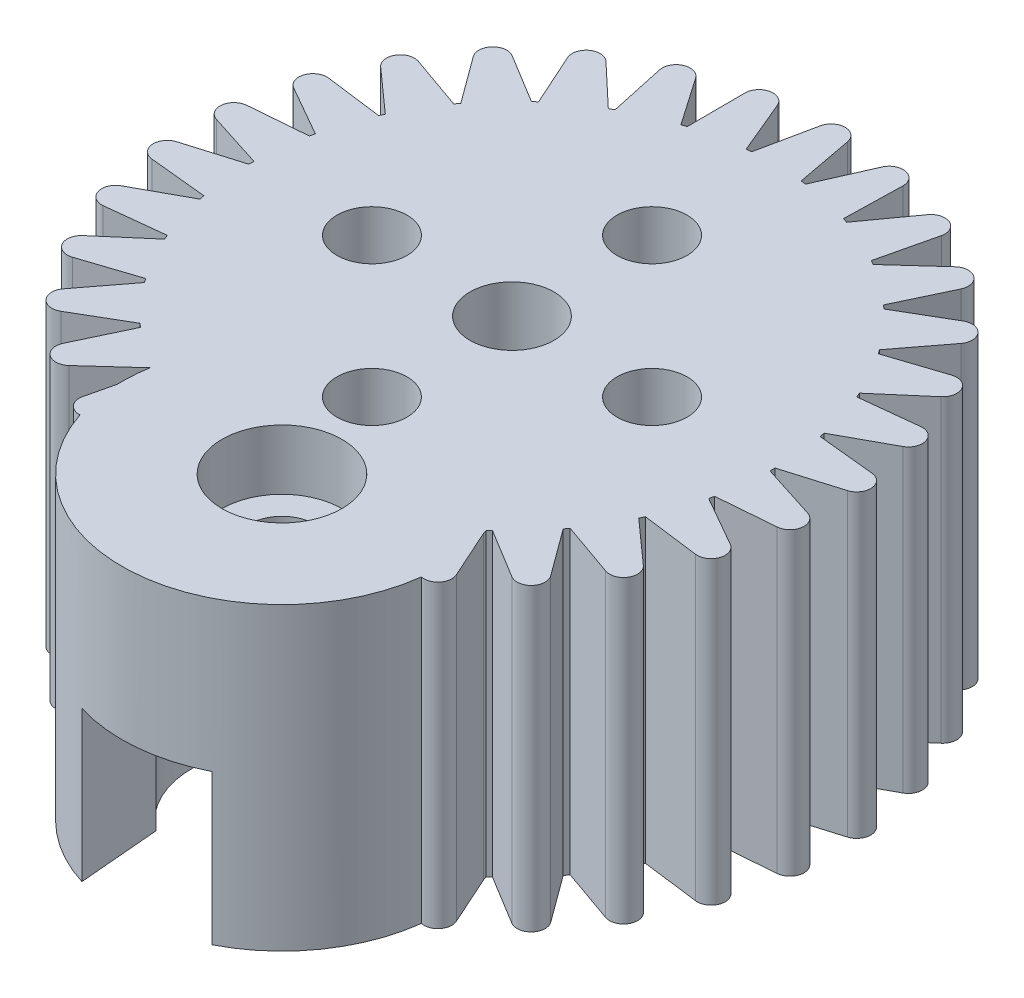
from build123d import *

# Parameters (mm, degrees)
SKETCH_1_R          = 2.1
SKETCH_1_R_2        = 1.75
EXTRUDE_1_DEPTH     = 15
EXTRUDE_4_DEPTH     = 15
CUT_EXTRUDE_2_DEPTH = 7.5
SKETCH_6_R          = 3
CUT_EXTRUDE_3_DEPTH = 3
SKETCH_7_R          = 1.65
CUT_EXTRUDE_4_DEPTH = 7.5


with BuildPart() as part:
    # 草图1 → 凸台-拉伸1 (new body)
    with BuildSketch(Plane(origin=(0, 0, 0), x_dir=(1, 0, 0), z_dir=(0, 1, 0))):
        with BuildLine():
            Line((13.15, 0), (15.928328767, 0.831197488))
            ThreePointArc((15.928328767, 0.831197488), (16.42452517, 1.568368494), (15.797783898, 2.198310824))
            Line((15.797783898, 2.198310824), (12.912357414, 2.48867957))
            ThreePointArc((12.912357414, 2.48867957), (12.888083079, 2.611477465), (12.86264095, 2.734038734))
            Line((12.86264095, 2.734038734), (15.407440892, 4.124719594))
            ThreePointArc((15.407440892, 4.124719594), (15.739527743, 4.948946678), (14.995509896, 5.43481642))
            Line((14.995509896, 5.43481642), (12.112765847, 5.118926013))
            ThreePointArc((12.112765847, 5.118926013), (12.063490846, 5.233993562), (12.013122768, 5.348586856))
            Line((12.013122768, 5.348586856), (14.213173917, 7.237971662))
            ThreePointArc((14.213173917, 7.237971662), (14.366637427, 8.113232145), (13.537860156, 8.433794459))
            Line((13.537860156, 8.433794459), (10.783788289, 7.525450826))
            ThreePointArc((10.783788289, 7.525450826), (10.711666177, 7.627759024), (10.638573476, 7.729376068))
            Line((10.638573476, 7.729376068), (12.397723039, 10.034889636))
            ThreePointArc((12.397723039, 10.034889636), (12.365856116, 10.922930435), (11.488540964, 11.06417521))
            Line((11.488540964, 11.06417521), (8.983507437, 9.603077326))
            ThreePointArc((8.983507437, 9.603077326), (8.891690295, 9.688154814), (8.799067474, 9.772354455))
            Line((8.799067474, 9.772354455), (10.040432174, 12.393234781))
            ThreePointArc((10.040432174, 12.393234781), (9.824627556, 13.255244252), (8.937117405, 13.210998413))
            Line((8.937117405, 13.210998413), (6.790604202, 11.261003267))
            ThreePointArc((6.790604202, 11.261003267), (6.68310488, 11.32513175), (6.575, 11.38823406))
            Line((6.575, 11.38823406), (7.244326243, 14.209936096))
            ThreePointArc((7.244326243, 14.209936096), (6.854015627, 15.008240289), (5.99509893, 14.780437591))
            Line((5.99509893, 14.780437591), (4.300918978, 12.426769329))
            ThreePointArc((4.300918978, 12.426769329), (4.182435713, 12.467146085), (4.063573476, 12.506393189))
            Line((4.063573476, 12.506393189), (4.131608494, 15.405595017))
            ThreePointArc((4.131608494, 15.405595017), (3.583850326, 16.105304208), (2.791065864, 15.703900723))
            Line((2.791065864, 15.703900723), (1.623262957, 13.04942594))
            ThreePointArc((1.623262957, 13.04942594), (1.498974036, 13.064286312), (1.374549292, 13.077962924))
            Line((1.374549292, 13.077962924), (0.838319627, 15.927955511))
            ThreePointArc((0.838319627, 15.927955511), (0.157053569, 16.498489051), (-0.534950174, 15.941028037))
            Line((-0.534950174, 15.941028037), (-1.125337445, 13.10176002))
            ThreePointArc((-1.125337445, 13.10176002), (-1.25, 13.090454538), (-1.374549292, 13.077962924))
            Line((-1.374549292, 13.077962924), (-2.49160783, 15.754187919))
            ThreePointArc((-2.49160783, 15.754187919), (-3.276607183, 16.170610754), (-3.837586321, 15.481455933))
            Line((-3.837586321, 15.481455933), (-3.8247552, 12.581484318))
            ThreePointArc((-3.8247552, 12.581484318), (-3.944343037, 12.544507085), (-4.063573476, 12.506393189))
            Line((-4.063573476, 12.506393189), (-5.712640068, 14.891886718))
            ThreePointArc((-5.712640068, 14.891886718), (-6.567064478, 15.135999172), (-6.972501532, 14.345269916))
            Line((-6.972501532, 14.345269916), (-6.3570128, 11.511337379))
            ThreePointArc((-6.3570128, 11.511337379), (-6.466299357, 11.450304477), (-6.575, 11.38823406))
            Line((-6.575, 11.38823406), (-8.684002523, 13.378738608))
            ThreePointArc((-8.684002523, 13.378738608), (-9.570509543, 13.439871795), (-9.802684968, 12.582126767))
            Line((-9.802684968, 12.582126767), (-8.611438437, 9.938089759))
            ThreePointArc((-8.611438437, 9.938089759), (-8.705647366, 9.85566862), (-8.799067474, 9.772354455))
            Line((-8.799067474, 9.772354455), (-11.275832398, 11.280875422))
            ThreePointArc((-11.275832398, 11.280875422), (-12.155677416, 11.15635753), (-12.204444033, 10.269084303))
            Line((-12.204444033, 10.269084303), (-10.489502891, 7.930499928))
            ThreePointArc((-10.489502891, 7.930499928), (-10.564516811, 7.83029275), (-10.638573476, 7.729376068))
            Line((-10.638573476, 7.729376068), (-13.374854289, 8.689983849))
            ThreePointArc((-13.374854289, 8.689983849), (-14.209583858, 8.385256906), (-14.072810329, 7.507233578))
            Line((-14.072810329, 7.507233578), (-11.909125735, 5.576309195))
            ThreePointArc((-11.909125735, 5.576309195), (-11.961666177, 5.462695514), (-12.013122768, 5.348586856))
            Line((-12.013122768, 5.348586856), (-14.889330869, 5.719298283))
            ThreePointArc((-14.889330869, 5.719298283), (-15.642463299, 5.247680319), (-15.326127286, 4.417280723))
            Line((-15.326127286, 4.417280723), (-12.808262637, 2.978406992))
            ThreePointArc((-12.808262637, 2.978406992), (-12.836033332, 2.856352271), (-12.86264095, 2.734038734))
            Line((-12.86264095, 2.734038734), (-15.753072242, 2.498651937))
            ThreePointArc((-15.753072242, 2.498651937), (-16.391692033, 1.88075492), (-15.909618937, 1.134271503))
            Line((-15.909618937, 1.134271503), (-13.147617002, 0.250334112))
            ThreePointArc((-13.147617002, 0.250334112), (-13.149404237, 0.125172727), (-13.15, 0))
            Line((-13.15, 0), (-15.928328767, -0.831197488))
            ThreePointArc((-15.928328767, -0.831197488), (-16.42452517, -1.568368494), (-15.797783898, -2.198310824))
            Line((-15.797783898, -2.198310824), (-12.912357414, -2.48867957))
            ThreePointArc((-12.912357414, -2.48867957), (-12.888083079, -2.611477465), (-12.86264095, -2.734038734))
            Line((-12.86264095, -2.734038734), (-15.407440892, -4.124719594))
            ThreePointArc((-15.407440892, -4.124719594), (-15.739527743, -4.948946678), (-14.995509896, -5.43481642))
            Line((-14.995509896, -5.43481642), (-12.112765847, -5.118926013))
            ThreePointArc((-12.112765847, -5.118926013), (-12.063490846, -5.233993562), (-12.013122768, -5.348586856))
            Line((-12.013122768, -5.348586856), (-14.213173917, -7.237971662))
            ThreePointArc((-14.213173917, -7.237971662), (-14.366637427, -8.113232145), (-13.537860156, -8.433794459))
            Line((-13.537860156, -8.433794459), (-10.783788289, -7.525450826))
            ThreePointArc((-10.783788289, -7.525450826), (-10.711666177, -7.627759024), (-10.638573476, -7.729376068))
            Line((-10.638573476, -7.729376068), (-12.397723039, -10.034889636))
            ThreePointArc((-12.397723039, -10.034889636), (-12.365856116, -10.922930435), (-11.488540964, -11.06417521))
            Line((-11.488540964, -11.06417521), (-8.983507437, -9.603077326))
            ThreePointArc((-8.983507437, -9.603077326), (-8.891690295, -9.688154814), (-8.799067474, -9.772354455))
            Line((-8.799067474, -9.772354455), (-10.040432174, -12.393234781))
            ThreePointArc((-10.040432174, -12.393234781), (-9.824627556, -13.255244252), (-8.937117405, -13.210998413))
            Line((-8.937117405, -13.210998413), (-6.790604202, -11.261003267))
            ThreePointArc((-6.790604202, -11.261003267), (-6.68310488, -11.32513175), (-6.575, -11.38823406))
            Line((-6.575, -11.38823406), (-7.244326243, -14.209936096))
            ThreePointArc((-7.244326243, -14.209936096), (-6.854015627, -15.008240289), (-5.99509893, -14.780437591))
            Line((-5.99509893, -14.780437591), (-4.300918978, -12.426769329))
            ThreePointArc((-4.300918978, -12.426769329), (-4.182435713, -12.467146085), (-4.063573476, -12.506393189))
            Line((-4.063573476, -12.506393189), (-4.131608494, -15.405595017))
            ThreePointArc((-4.131608494, -15.405595017), (-3.583850326, -16.105304208), (-2.791065864, -15.703900723))
            Line((-2.791065864, -15.703900723), (-1.623262957, -13.04942594))
            ThreePointArc((-1.623262957, -13.04942594), (-1.498974036, -13.064286312), (-1.374549292, -13.077962924))
            Line((-1.374549292, -13.077962924), (-0.838319627, -15.927955511))
            ThreePointArc((-0.838319627, -15.927955511), (-0.157053569, -16.498489051), (0.534950174, -15.941028037))
            Line((0.534950174, -15.941028037), (1.125337445, -13.10176002))
            ThreePointArc((1.125337445, -13.10176002), (1.25, -13.090454538), (1.374549292, -13.077962924))
            Line((1.374549292, -13.077962924), (2.49160783, -15.754187919))
            ThreePointArc((2.49160783, -15.754187919), (3.276607183, -16.170610754), (3.837586321, -15.481455933))
            Line((3.837586321, -15.481455933), (3.8247552, -12.581484318))
            ThreePointArc((3.8247552, -12.581484318), (3.944343037, -12.544507085), (4.063573476, -12.506393189))
            Line((4.063573476, -12.506393189), (5.712640068, -14.891886718))
            ThreePointArc((5.712640068, -14.891886718), (6.567064478, -15.135999172), (6.972501532, -14.345269916))
            Line((6.972501532, -14.345269916), (6.3570128, -11.511337379))
            ThreePointArc((6.3570128, -11.511337379), (6.466299357, -11.450304477), (6.575, -11.38823406))
            Line((6.575, -11.38823406), (8.684002523, -13.378738608))
            ThreePointArc((8.684002523, -13.378738608), (9.570509543, -13.439871795), (9.802684968, -12.582126767))
            Line((9.802684968, -12.582126767), (8.611438437, -9.938089759))
            ThreePointArc((8.611438437, -9.938089759), (8.705647366, -9.85566862), (8.799067474, -9.772354455))
            Line((8.799067474, -9.772354455), (11.275832398, -11.280875422))
            ThreePointArc((11.275832398, -11.280875422), (12.155677416, -11.15635753), (12.204444033, -10.269084303))
            Line((12.204444033, -10.269084303), (10.489502891, -7.930499928))
            ThreePointArc((10.489502891, -7.930499928), (10.564516811, -7.83029275), (10.638573476, -7.729376068))
            Line((10.638573476, -7.729376068), (13.374854289, -8.689983849))
            ThreePointArc((13.374854289, -8.689983849), (14.209583858, -8.385256906), (14.072810329, -7.507233578))
            Line((14.072810329, -7.507233578), (11.909125735, -5.576309195))
            ThreePointArc((11.909125735, -5.576309195), (11.961666177, -5.462695514), (12.013122768, -5.348586856))
            Line((12.013122768, -5.348586856), (14.889330869, -5.719298283))
            ThreePointArc((14.889330869, -5.719298283), (15.642463299, -5.247680319), (15.326127286, -4.417280723))
            Line((15.326127286, -4.417280723), (12.808262637, -2.978406992))
            ThreePointArc((12.808262637, -2.978406992), (12.836033332, -2.856352271), (12.86264095, -2.734038734))
            Line((12.86264095, -2.734038734), (15.753072242, -2.498651937))
            ThreePointArc((15.753072242, -2.498651937), (16.391692033, -1.88075492), (15.909618937, -1.134271503))
            Line((15.909618937, -1.134271503), (13.147617002, -0.250334112))
            ThreePointArc((13.147617002, -0.250334112), (13.149404237, -0.125172727), (13.15, 0))
        make_face()
        with Locations(Location((0, 0, 0), (0, 0, 270))):
            Circle(SKETCH_1_R, mode=Mode.SUBTRACT)
        with Locations(Location((0, 7, 0), (0, 0, 270))):
            Circle(SKETCH_1_R_2, mode=Mode.SUBTRACT)
        with Locations(Location((7, 0, 0), (0, 0, 270))):
            Circle(SKETCH_1_R_2, mode=Mode.SUBTRACT)
        with Locations(Location((0, -7, 0), (0, 0, 270))):
            Circle(SKETCH_1_R_2, mode=Mode.SUBTRACT)
        with Locations(Location((-7, 0, 0), (0, 0, 270))):
            Circle(SKETCH_1_R_2, mode=Mode.SUBTRACT)
    extrude(amount=EXTRUDE_1_DEPTH)

    # 草图2 → 凸台-拉伸4 (add)
    with BuildSketch(Plane.XZ):
        with BuildLine():
            ThreePointArc((8.628301334, 9.923452831), (1.127142857, 13.101604825), (-6.80661548, 11.251332619))
            ThreePointArc((-6.80661548, 11.251332619), (1.767985784, 20.55059031), (8.628301334, 9.923452831))
        make_face()
    extrude(amount=-EXTRUDE_4_DEPTH)

    # 草图5 → 切除-拉伸2 (cut)
    with BuildSketch(Plane.XZ):
        with BuildLine():
            Line((-1.619193239, 16.178934134), (-1.271013628, 20.226080108))
            ThreePointArc((-1.271013628, 20.226080108), (1.767985784, 20.55059031), (4.706904923, 19.711794394))
            Line((4.706904923, 19.711794394), (4.358725312, 15.66464842))
            ThreePointArc((4.358725312, 15.66464842), (5.268553565, 10.929262742), (1.371565714, 8.089341854))
            ThreePointArc((1.371565714, 8.089341854), (0.333501893, 8.719486746), (-0.864869727, 8.523108183))
            ThreePointArc((-0.864869727, 8.523108183), (-3.396043111, 12.138787805), (-1.619193239, 16.178934134))
        make_face()
    extrude(amount=-CUT_EXTRUDE_2_DEPTH, mode=Mode.SUBTRACT)

    # 草图6 → 切除-拉伸3 (cut)
    with BuildSketch(Plane(origin=(0, 15, 0), x_dir=(1, 0, 0), z_dir=(0, 1, 0))):
        with Locations(Location((1.082271582, -12.580033216, 0), (0, 0, 270))):
            Circle(SKETCH_6_R)
    extrude(amount=-CUT_EXTRUDE_3_DEPTH, mode=Mode.SUBTRACT)

    # 草图7 → 切除-拉伸4 (cut)
    with BuildSketch(Plane.XZ.offset(-7.5)):
        with Locations(Location((1.082271582, 12.580033216, 0), (0, 0, 270))):
            Circle(SKETCH_7_R)
    extrude(amount=-CUT_EXTRUDE_4_DEPTH, mode=Mode.SUBTRACT)


solid = part.part
